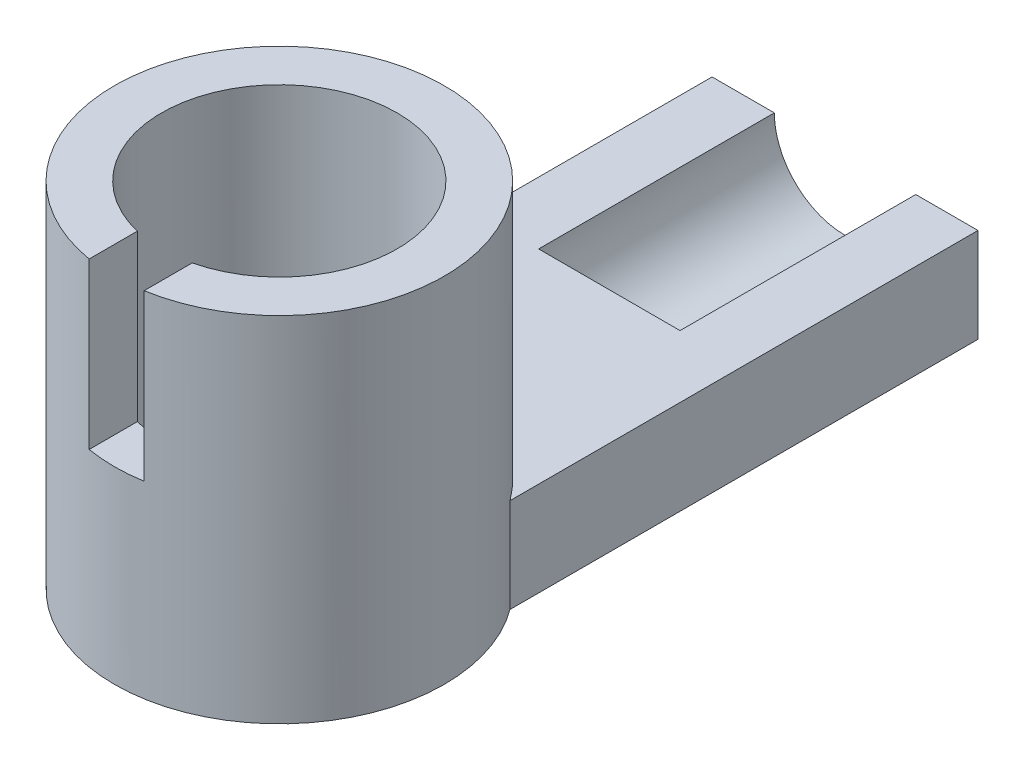
from build123d import *

# Parameters (mm, degrees)
SKETCH3_R               = 70000
SKETCH3_R_2             = 50000
BOSS_EXTRUDE1_DEPTH     = 150000
SKETCH7_W               = 112822.571730932
SKETCH7_H               = 198557.786962263
BOSS_EXTRUDE3_DEPTH     = 40000
SKETCH8_R               = 30000
CUT_EXTRUDE1_DEPTH      = 100000
CUT_EXTRUDE2_DEPTH      = 26529
CUT_EXTRUDE2_DEPTH_BACK = 86482
SKETCH9_R               = 50000
CUT_EXTRUDE4_DEPTH      = 43724
CUT_EXTRUDE4_DEPTH_BACK = 70000
SKETCH11_W              = 23317.46593379
SKETCH11_H              = 104003.866310114


with BuildPart() as part:
    # Sketch3 → Boss-Extrude1 (new body)
    with BuildSketch(Plane(origin=(0, 0, 0), x_dir=(1, 0, 0), z_dir=(0, 1, 0))):
        with Locations(Location((0, 0, 0), (0, 0, 270))):
            Circle(SKETCH3_R)
        with Locations(Location((0, 0, 0), (0, 0, 270))):
            Circle(SKETCH3_R_2, mode=Mode.SUBTRACT)
    extrude(amount=BOSS_EXTRUDE1_DEPTH)

    # Sketch7 → Boss-Extrude3 (add)
    with BuildSketch(Plane.XZ):
        with Locations((0, -140724.844151912)):
            Rectangle(SKETCH7_W, SKETCH7_H)
    extrude(amount=-BOSS_EXTRUDE3_DEPTH)

    # Sketch8 → Cut-Extrude1 (cut)
    with BuildSketch(Plane(origin=(0, 0, -240003.737633043), x_dir=(-1, 0, 0), z_dir=(0, 0, -1))):
        with Locations((0, 40000)):
            Circle(SKETCH8_R)
    extrude(amount=-CUT_EXTRUDE1_DEPTH, mode=Mode.SUBTRACT)

    # Sketch9 → Cut-Extrude2 (cut, two sides: drawn at the far end of the back side and taken through both)
    with BuildSketch(Plane(origin=(0, 40000, 0), x_dir=(1, 0, 0), z_dir=(0, 1, 0)).offset(-CUT_EXTRUDE2_DEPTH_BACK)):
        with Locations(Location((0, 0, 0), (0, 0, 270))):
            Circle(SKETCH9_R)
    extrude(amount=CUT_EXTRUDE2_DEPTH + CUT_EXTRUDE2_DEPTH_BACK, mode=Mode.SUBTRACT)

    # Sketch11 → Cut-Extrude4 (cut, two sides: drawn at the far end of the back side and taken through both)
    with BuildSketch(Plane(origin=(0, 150000, 0), x_dir=(1, 0, 0), z_dir=(0, 1, 0)).offset(-CUT_EXTRUDE4_DEPTH_BACK)):
        with Locations((0, -32001.933155057)):
            Rectangle(SKETCH11_W, SKETCH11_H)
    extrude(amount=CUT_EXTRUDE4_DEPTH + CUT_EXTRUDE4_DEPTH_BACK, mode=Mode.SUBTRACT)


solid = part.part
